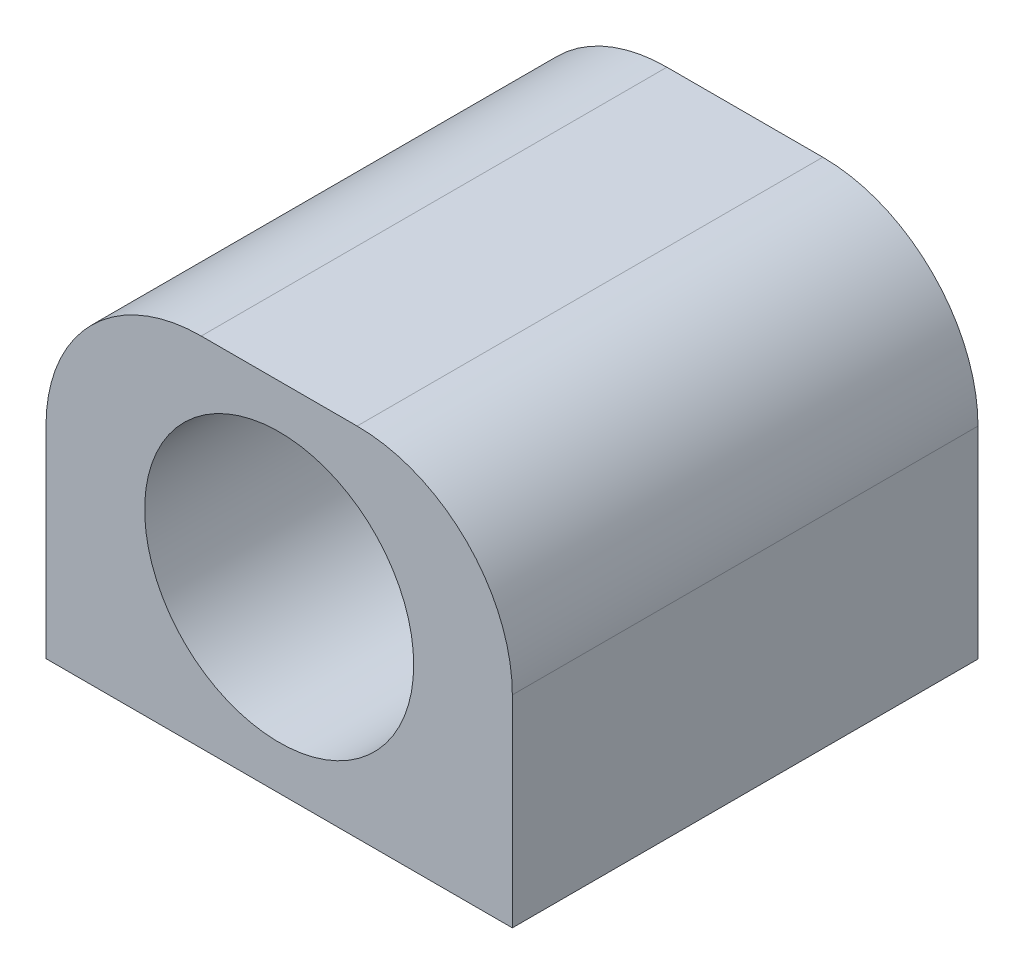
from build123d import *

# Parameters (mm, degrees)
EXTRUDE_START   = -30
SKETCH_1_R      = 8.666666667
EXTRUDE_1_DEPTH = 30


with BuildPart() as part:
    # 草图1 → 凸台-拉伸1 (new body)
    with BuildSketch(Plane.XY.offset(EXTRUDE_START)):
        with BuildLine():
            Line((47.521768078, 23), (37.478231922, 23))
            ThreePointArc((37.478231922, 23), (30.40716411, 20.071067812), (27.478231922, 13))
            Line((27.478231922, 13), (27.478231922, 0))
            Line((27.478231922, 0), (57.521768078, 0))
            Line((57.521768078, 0), (57.521768078, 13))
            ThreePointArc((57.521768078, 13), (54.59283589, 20.071067812), (47.521768078, 23))
        make_face()
        with Locations((42.5, 11.5)):
            Circle(SKETCH_1_R, mode=Mode.SUBTRACT)
    extrude(amount=-EXTRUDE_1_DEPTH)


solid = part.part
